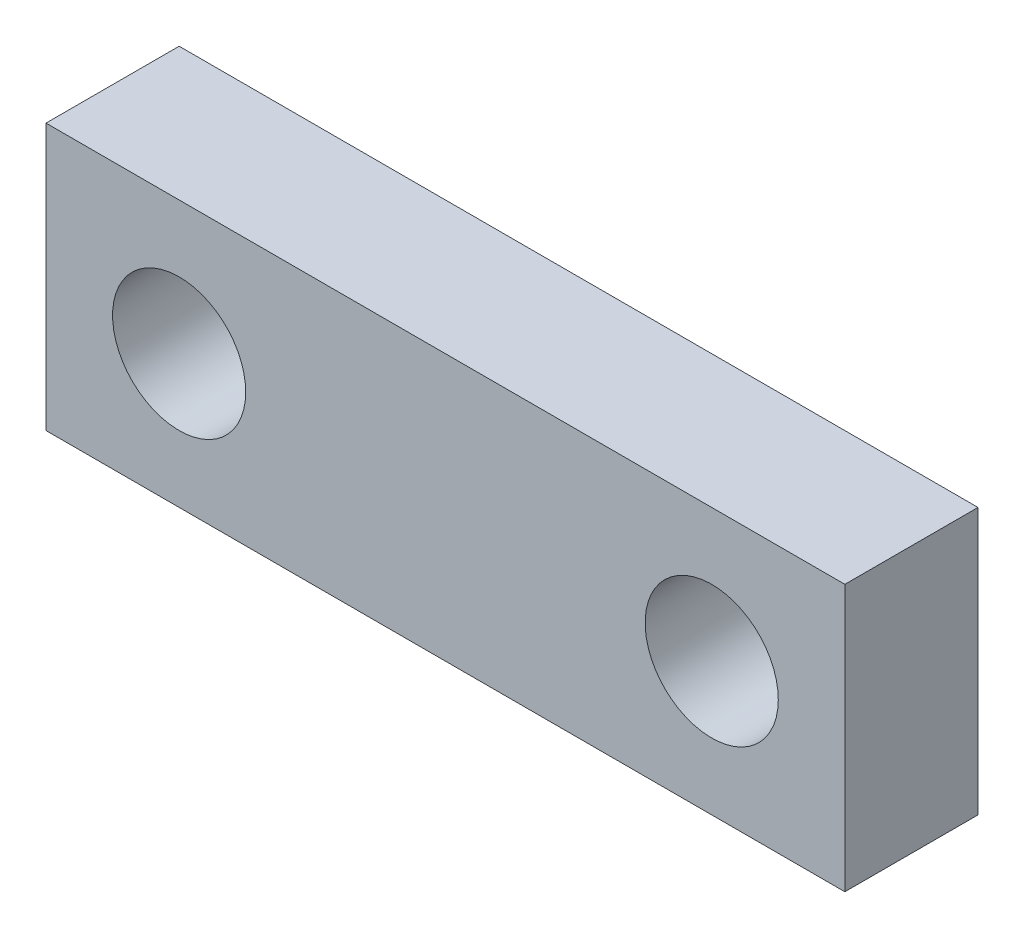
from build123d import *

# Parameters (mm, degrees)
SKETCH1_W           = 30
SKETCH1_H           = 10
SKETCH1_R           = 2.5
BOSS_EXTRUDE1_DEPTH = 5


with BuildPart() as part:
    # Sketch1 → Boss-Extrude1 (new body)
    with BuildSketch(Plane.XY):
        with Locations((-15, 5)):
            Rectangle(SKETCH1_W, SKETCH1_H)
        with Locations((-25, 5)):
            Circle(SKETCH1_R, mode=Mode.SUBTRACT)
        with Locations((-5, 5)):
            Circle(SKETCH1_R, mode=Mode.SUBTRACT)
    extrude(amount=BOSS_EXTRUDE1_DEPTH)


solid = part.part
